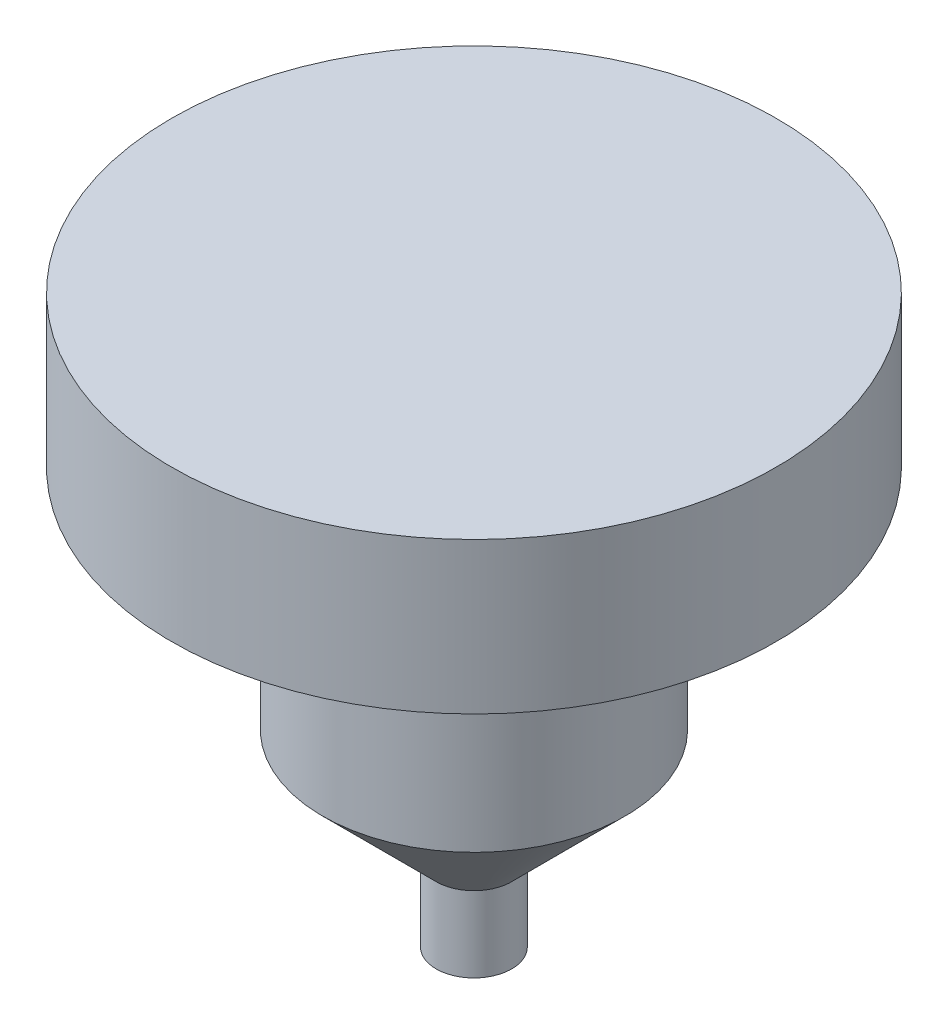
from build123d import *


with BuildPart() as part:
    # Sketch1 → Revolve1 (revolve)
    with BuildSketch(Plane.XY, mode=Mode.PRIVATE) as revolve1_sk:
        Polygon((0, 0), (1, 0), (5, 2.309401077), (5, 12.309401077), (20, 27.309401077), (20, 57.309401077), (40, 57.309401077), (40, 77.309401077), (0, 77.309401077), align=None)
    revolve(revolve1_sk.sketch.rotate(Axis((0, 77.309401077, 0), (0, -1, 0)), 180), axis=Axis((0, 77.309401077, 0), (0, -1, 0)))


solid = part.part
